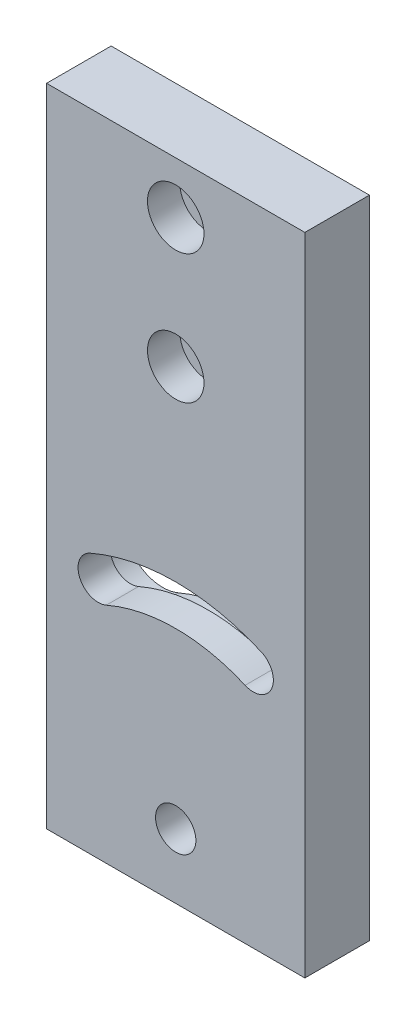
from build123d import *

# Parameters (mm, degrees)
SKETCH1_W           = 50.8
SKETCH1_H           = 127
SKETCH1_R           = 3.96875
SKETCH1_R_2         = 3.3734375
BOSS_EXTRUDE2_DEPTH = 12.7
CUT_EXTRUDE1_DEPTH  = 6.35
CUT_EXTRUDE2_START  = -12.7
SKETCH3_R           = 5.55625
CUT_EXTRUDE2_DEPTH  = 6.35
CUT_EXTRUDE3_START  = -12.7
SKETCH4_R           = 7.62
CUT_EXTRUDE3_DEPTH  = 6.35


with BuildPart() as part:
    # Sketch1 → Boss-Extrude2 (new body)
    with BuildSketch(Plane.XY):
        with Locations((25.4, 63.5)):
            Rectangle(SKETCH1_W, SKETCH1_H)
        with Locations((25.4, 12.7)):
            Circle(SKETCH1_R, mode=Mode.SUBTRACT)
        with Locations((25.4, 116.84)):
            Circle(SKETCH1_R_2, mode=Mode.SUBTRACT)
        with Locations((25.4, 91.44)):
            Circle(SKETCH1_R_2, mode=Mode.SUBTRACT)
        with BuildLine():
            ThreePointArc((42.2275, 51.256646253), (25.4, 54.76875), (8.5725, 51.256646253))
            ThreePointArc((8.5725, 51.256646253), (6.522580542, 46.031726796), (11.7475, 43.981807338))
            ThreePointArc((11.7475, 43.981807338), (25.4, 46.83125), (39.0525, 43.981807338))
            ThreePointArc((39.0525, 43.981807338), (44.277419458, 46.031726796), (42.2275, 51.256646253))
        make_face(mode=Mode.SUBTRACT)
    extrude(amount=BOSS_EXTRUDE2_DEPTH)

    # Sketch1<3> → Cut-Extrude1 (cut)
    with BuildSketch(Plane.XY):
        with BuildLine():
            ThreePointArc((37.5285, 40.489884658), (25.4, 43.02125), (13.2715, 40.489884658))
            ThreePointArc((13.2715, 40.489884658), (3.030657863, 44.507726796), (7.0485, 54.748568933))
            ThreePointArc((7.0485, 54.748568933), (25.4, 58.57875), (43.7515, 54.748568933))
            ThreePointArc((43.7515, 54.748568933), (47.769342137, 44.507726796), (37.5285, 40.489884658))
        make_face()
        with BuildLine():
            ThreePointArc((39.0525, 43.981807338), (44.277419458, 46.031726796), (42.2275, 51.256646253))
            ThreePointArc((42.2275, 51.256646253), (25.4, 54.76875), (8.5725, 51.256646253))
            ThreePointArc((8.5725, 51.256646253), (6.522580542, 46.031726796), (11.7475, 43.981807338))
            ThreePointArc((11.7475, 43.981807338), (25.4, 46.83125), (39.0525, 43.981807338))
        make_face(mode=Mode.SUBTRACT)
    extrude(amount=CUT_EXTRUDE1_DEPTH, mode=Mode.SUBTRACT)

    # Sketch3 → Cut-Extrude2 (cut)
    with BuildSketch(Plane(origin=(0, 0, 0), x_dir=(-1, 0, 0), z_dir=(0, 0, -1)).offset(CUT_EXTRUDE2_START)):
        with Locations(Location((-25.4, 116.84, 0), (0, 0, 180))):
            Circle(SKETCH3_R)
        with Locations(Location((-25.4, 91.44, 0), (0, 0, 180))):
            Circle(SKETCH3_R)
    extrude(amount=CUT_EXTRUDE2_DEPTH, mode=Mode.SUBTRACT)

    # Sketch4 → Cut-Extrude3 (cut)
    with BuildSketch(Plane.XY.offset(12.7).offset(CUT_EXTRUDE3_START)):
        with Locations((25.4, 12.7)):
            Circle(SKETCH4_R)
    extrude(amount=CUT_EXTRUDE3_DEPTH, mode=Mode.SUBTRACT)


solid = part.part
